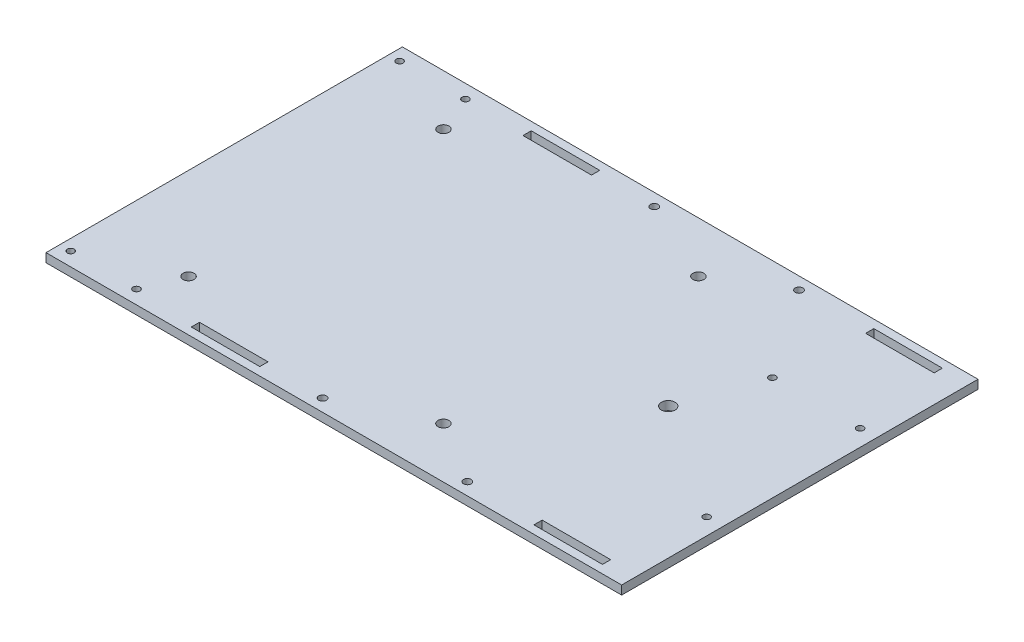
from build123d import *

# Parameters (mm, degrees)
SKETCH2_W         = 210
SKETCH2_H         = 130
SKETCH2_R         = 2
SKETCH2_R_2       = 1.25
MAIN_DEPTH        = 3.2
SKETCH3_R         = 1.25
MOTOR_MOUNT_DEPTH = 3.2
SKETCH4_R         = 1.4
SKETCH4_W         = 25
SKETCH4_H         = 3
SIDE_HOLES_DEPTH  = 3.2
SKETCH5_R         = 2.5
BACK_WHEEL_DEPTH  = 3.2


with BuildPart() as part:
    # Sketch2 → main (new body)
    with BuildSketch(Plane(origin=(0, 0, 0), x_dir=(1, 0, 0), z_dir=(0, 1, 0))):
        with Locations((25, 0)):
            Rectangle(SKETCH2_W, SKETCH2_H)
        with Locations(Location((-46.5, 46.5, 0), (0, 0, 270))):
            Circle(SKETCH2_R, mode=Mode.SUBTRACT)
        with Locations(Location((46.5, 46.5, 0), (0, 0, 270))):
            Circle(SKETCH2_R, mode=Mode.SUBTRACT)
        with Locations(Location((-46.5, -46.5, 0), (0, 0, 270))):
            Circle(SKETCH2_R, mode=Mode.SUBTRACT)
        with Locations(Location((46.5, -46.5, 0), (0, 0, 270))):
            Circle(SKETCH2_R, mode=Mode.SUBTRACT)
        with Locations(Location((92, 28, 0), (0, 0, 270))):
            Circle(SKETCH2_R_2, mode=Mode.SUBTRACT)
        with Locations(Location((124, 28, 0), (0, 0, 270))):
            Circle(SKETCH2_R_2, mode=Mode.SUBTRACT)
        with Locations(Location((124, -28, 0), (0, 0, 270))):
            Circle(SKETCH2_R_2, mode=Mode.SUBTRACT)
    extrude(amount=MAIN_DEPTH)

    # Sketch3 → motor mount (cut)
    with BuildSketch(Plane(origin=(0, 3.2, 0), x_dir=(1, 0, 0), z_dir=(0, 1, 0))):
        with Locations(Location((-76, -60, 0), (0, 0, 270))):
            Circle(SKETCH3_R)
        with Locations(Location((-52, -60, 0), (0, 0, 270))):
            Circle(SKETCH3_R)
        with Locations(Location((-52, 60, 0), (0, 0, 270))):
            Circle(SKETCH3_R)
        with Locations(Location((-76, 60, 0), (0, 0, 270))):
            Circle(SKETCH3_R)
    extrude(amount=-MOTOR_MOUNT_DEPTH, mode=Mode.SUBTRACT)

    # Sketch4 → side holes (cut)
    with BuildSketch(Plane(origin=(0, 3.2, 0), x_dir=(1, 0, 0), z_dir=(0, 1, 0))):
        with Locations(Location((16.4, -60.5, 0), (0, 0, 270))):
            Circle(SKETCH4_R)
        with Locations(Location((69.2, -60.5, 0), (0, 0, 270))):
            Circle(SKETCH4_R)
        with Locations(Location((69.2, 60.5, 0), (0, 0, 270))):
            Circle(SKETCH4_R)
        with Locations(Location((16.4, 60.5, 0), (0, 0, 270))):
            Circle(SKETCH4_R)
        with Locations((-17.5, -60.5)):
            Rectangle(SKETCH4_W, SKETCH4_H)
        with Locations((107.5, -60.5)):
            Rectangle(SKETCH4_W, SKETCH4_H)
        with Locations((107.5, 60.5)):
            Rectangle(SKETCH4_W, SKETCH4_H)
        with Locations((-17.5, 60.5)):
            Rectangle(SKETCH4_W, SKETCH4_H)
    extrude(amount=-SIDE_HOLES_DEPTH, mode=Mode.SUBTRACT)

    # Sketch5 → back wheel (cut)
    with BuildSketch(Plane(origin=(0, 3.2, 0), x_dir=(1, 0, 0), z_dir=(0, 1, 0))):
        with Locations(Location((82, 0, 0), (0, 0, 270))):
            Circle(SKETCH5_R)
    extrude(amount=-BACK_WHEEL_DEPTH, mode=Mode.SUBTRACT)


solid = part.part
